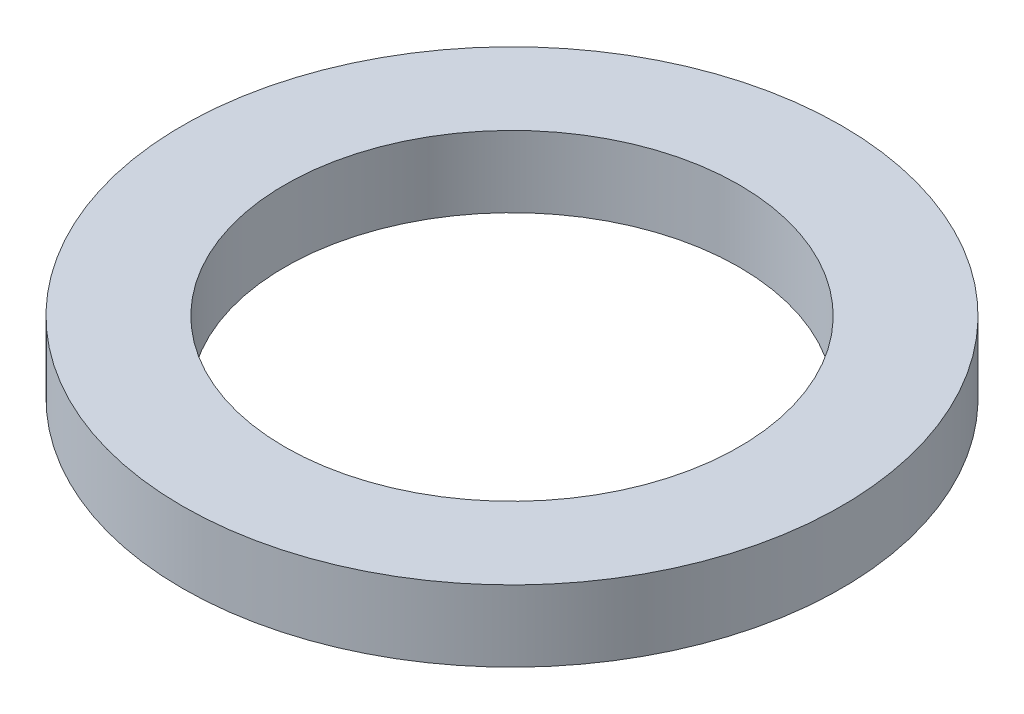
from build123d import *

# Parameters (mm, degrees)
SKETCH1_R           = 18.5
SKETCH1_R_2         = 12.75
BOSS_EXTRUDE1_DEPTH = 4


with BuildPart() as part:
    # Sketch1 → Boss-Extrude1 (new body)
    with BuildSketch(Plane(origin=(0, 0, 0), x_dir=(1, 0, 0), z_dir=(0, 1, 0))):
        with Locations(Location((0, 0, 0), (0, 0, 270))):
            Circle(SKETCH1_R)
        with Locations(Location((0, 0, 0), (0, 0, 270))):
            Circle(SKETCH1_R_2, mode=Mode.SUBTRACT)
    extrude(amount=BOSS_EXTRUDE1_DEPTH)


solid = part.part
